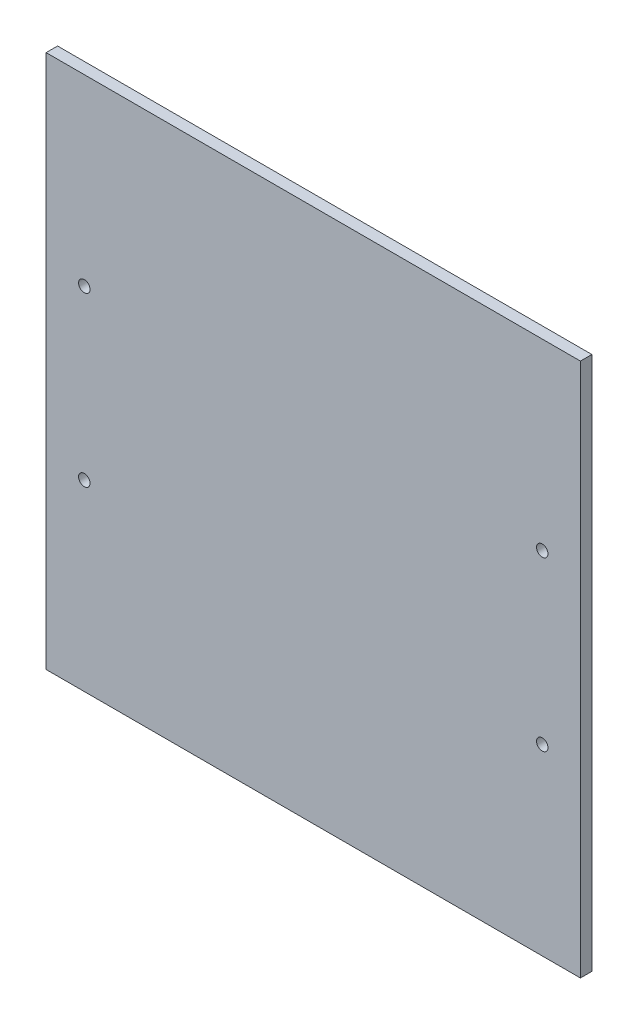
from build123d import *

# Parameters (mm, degrees)
SKETCH1_W             = 140
SKETCH1_H             = 140
BOSS_EXTRUDE1_DEPTH   = 3
M3X0_5_TAPPED_HOLE1_D = 3
SKETCH8_R             = 3
CUT_EXTRUDE2_DEPTH    = 2


with BuildPart() as part:
    # Sketch1 → Boss-Extrude1 (new body)
    with BuildSketch(Plane.XY):
        with Locations((70, 70)):
            Rectangle(SKETCH1_W, SKETCH1_H)
    extrude(amount=BOSS_EXTRUDE1_DEPTH)

    # M3x0.5 Tapped Hole1 (through all)
    with Locations(Plane(origin=(0, 0, 0), x_dir=(-1, 0, 0), z_dir=(0, 0, -1))):
        with Locations((-130, 92), (-130, 48), (-10, 92), (-10, 48)):
            Hole(M3X0_5_TAPPED_HOLE1_D / 2)

    # Sketch8 → Cut-Extrude2 (cut)
    with BuildSketch(Plane(origin=(0, 0, 0), x_dir=(-1, 0, 0), z_dir=(0, 0, -1))):
        with Locations((-70, 70)):
            Circle(SKETCH8_R)
    extrude(amount=-CUT_EXTRUDE2_DEPTH, mode=Mode.SUBTRACT)


solid = part.part
